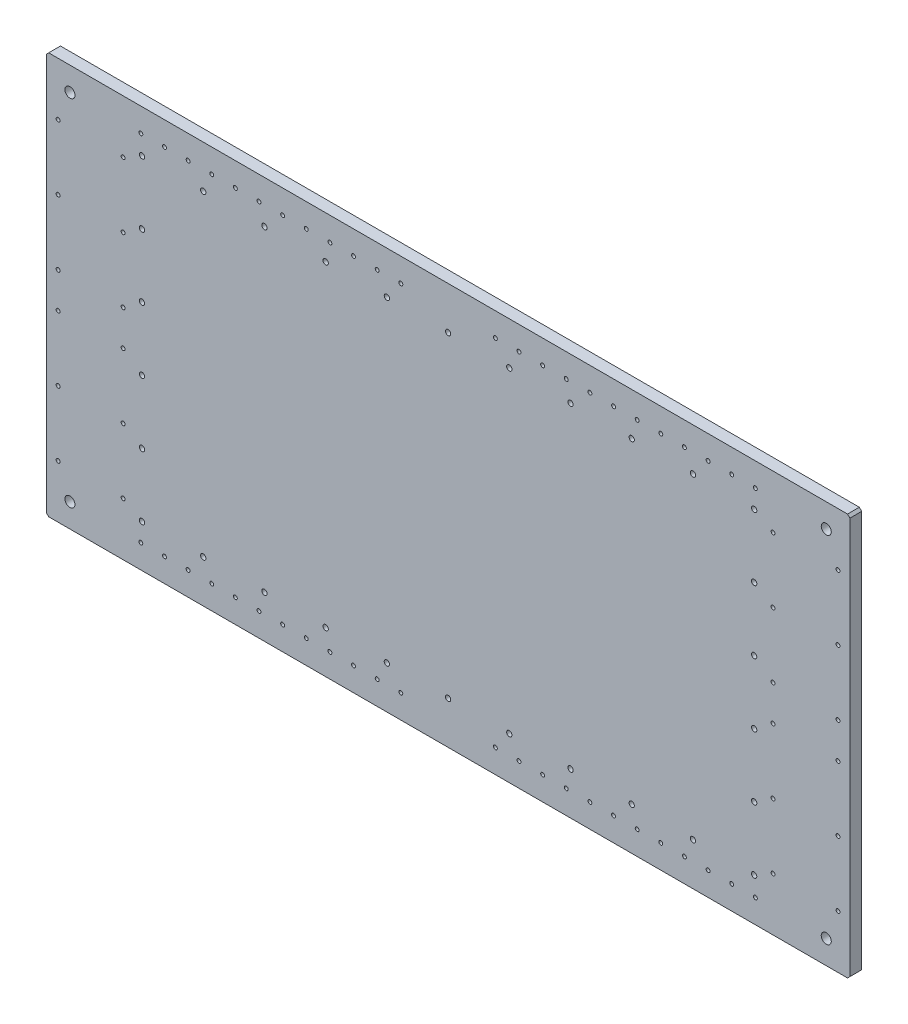
from build123d import *
from build123d.topology import SkipClean

# Parameters (mm, degrees)
SKETCH1_R              = 2.25
BOSS_EXTRUDE1_DEPTH    = 10
SKETCH2_W              = 10
SKETCH2_H              = 140
BOSS_EXTRUDE2_DEPTH    = 75
SKETCH3_W              = 340
SKETCH3_H              = 10
BOSS_EXTRUDE3_DEPTH    = 30
M10X1_5_TAPPED_HOLE1_D = 8.5
M4X0_7_TAPPED_HOLE1_D  = 3.3
LPATTERN1_COUNT        = 12
LPATTERN1_PITCH        = 20
M4X0_7_TAPPED_HOLE2_D  = 3.3
CHAMFER1_SIZE          = 2.5
MIRROR3_COPY_1_D       = 3.3
MIRROR3_COPY_2_D       = 3.3
MIRROR3_COPY_3_D       = 3.3
MIRROR3_COPY_4_D       = 3.3
MIRROR3_COPY_5_D       = 3.3
MIRROR3_COPY_6_D       = 3.3
MIRROR3_COPY_7_D       = 3.3
MIRROR3_COPY_8_D       = 3.3
MIRROR3_COPY_9_D       = 3.3
MIRROR3_COPY_10_D      = 3.3
MIRROR3_COPY_11_D      = 3.3
MIRROR4_COPY_1_D       = 8.5
MIRROR4_COPY_2_D       = 3.3
MIRROR4_COPY_3_D       = 3.3
MIRROR4_COPY_4_D       = 3.3
MIRROR4_COPY_5_D       = 3.3
MIRROR4_COPY_6_D       = 3.3
MIRROR4_COPY_7_D       = 3.3
MIRROR4_COPY_8_D       = 3.3
MIRROR4_COPY_9_D       = 3.3
MIRROR4_COPY_10_D      = 3.3
MIRROR4_COPY_11_D      = 3.3
MIRROR4_COPY_12_D      = 3.3
MIRROR4_COPY_13_D      = 3.3
MIRROR4_COPY_14_D      = 3.3
MIRROR4_COPY_15_D      = 8.5
MIRROR4_COPY_16_D      = 3.3
MIRROR4_COPY_17_D      = 3.3
CHAMFER2_SIZE          = 2


with BuildPart() as part:
    # Sketch1 → Boss-Extrude1 (new body)
    with BuildSketch(Plane.XY):
        with BuildLine():
            Line((265, 8.25), (265, 140))
            Line((265, 140), (0, 140))
            Line((0, 140), (0, 0))
            Line((0, 0), (265, 0))
            Line((265, 0), (265, 3.75))
            ThreePointArc((265, 3.75), (262.75, 6), (265, 8.25))
        make_face()
        with Locations((6, 113.2)):
            Circle(SKETCH1_R, mode=Mode.SUBTRACT)
        with Locations((6, 59.6)):
            Circle(SKETCH1_R, mode=Mode.SUBTRACT)
        with Locations((6, 6)):
            Circle(SKETCH1_R, mode=Mode.SUBTRACT)
        with Locations((57.8, 6)):
            Circle(SKETCH1_R, mode=Mode.SUBTRACT)
        with Locations((109.6, 6)):
            Circle(SKETCH1_R, mode=Mode.SUBTRACT)
        with Locations((161.4, 6)):
            Circle(SKETCH1_R, mode=Mode.SUBTRACT)
        with Locations((213.2, 6)):
            Circle(SKETCH1_R, mode=Mode.SUBTRACT)
    extrude(amount=BOSS_EXTRUDE1_DEPTH)

    # Sketch2 → Boss-Extrude2 (add)
    with BuildSketch(Plane.ZY):
        with Locations((5, 70)):
            Rectangle(SKETCH2_W, SKETCH2_H)
    extrude(amount=BOSS_EXTRUDE2_DEPTH)

    # Sketch3 → Boss-Extrude3 (add)
    with BuildSketch(Plane.XZ):
        with Locations((95, 5)):
            Rectangle(SKETCH3_W, SKETCH3_H)
    extrude(amount=BOSS_EXTRUDE3_DEPTH)

    # M10x1.5 Tapped Hole1 (through all)
    with Locations(Plane(origin=(-55, -10, 10), x_dir=(1, 0, 0), z_dir=(0, 0, 1))):
        with Locations((0, 0)):
            m10x1_5_tapped_hole1 = Hole(M10X1_5_TAPPED_HOLE1_D / 2)

    # M4x0.7 Tapped Hole1 (through all)
    with Locations(Plane(origin=(225, -10, 10), x_dir=(1, 0, 0), z_dir=(0, 0, 1))):
        with Locations((0, 0)):
            m4x0_7_tapped_hole1 = Hole(M4X0_7_TAPPED_HOLE1_D / 2)

    # LPattern1: M4x0.7 Tapped Hole1 ×12
    with Locations(*[(-i * LPATTERN1_PITCH, 0, 0) for i in range(1, LPATTERN1_COUNT)]):
        add(m4x0_7_tapped_hole1, mode=Mode.SUBTRACT)

    # M4x0.7 Tapped Hole2 (through all)
    with Locations(Plane(origin=(-10, 125, 10), x_dir=(1, 0, 0), z_dir=(0, 0, 1))):
        with Locations((0, 0), (0, -55), (0, -110), (-55, 0), (-55, -55), (-55, -110)):
            m4x0_7_tapped_hole2 = Hole(M4X0_7_TAPPED_HOLE2_D / 2)

    # Chamfer1
    chamfer1_edges = [part.edges().sort_by_distance(p)[0] for p in [
        (107.35, 6, 0),
        (159.15, 6, 0),
        (210.95, 6, 0),
        (55.55, 6, 0),
        (3.75, 6, 0),
        (3.75, 59.6, 0),
        (3.75, 113.2, 0),
        (262.75, 6, 0),
    ]]
    chamfer(chamfer1_edges, length=CHAMFER1_SIZE)

    # Mirror1: part across plane


with BuildPart() as part_1:
    with SkipClean():  # the faces are left unmerged after this step: merging them gives an invalid solid
        add(part.part)
        add(part.part.mirror(Plane(origin=(265, 8.25, 10), x_dir=(0, 0, 1), z_dir=(-1, 0, 0))))

    # Mirror2: part across plane


with BuildPart() as part_2:
    with SkipClean():  # the faces are left unmerged after this step: merging them gives an invalid solid
        add(part_1.part)
        add(part_1.part.mirror(Plane(origin=(0, 140, 10), x_dir=(0, 0, 1), z_dir=(0, 1, 0))))

    # Mirror3: M10x1.5 Tapped Hole1, M4x0.7 Tapped Hole1, M4x0.7 Tapped Hole2 across plane
    with SkipClean():  # the faces are left unmerged after this step: merging them gives an invalid solid
        add(m10x1_5_tapped_hole1.mirror(Plane(origin=(265, 0, 0), x_dir=(0, 0, 1), z_dir=(1, 0, 0))), mode=Mode.SUBTRACT)
        add(m4x0_7_tapped_hole1.mirror(Plane(origin=(265, 0, 0), x_dir=(0, 0, 1), z_dir=(1, 0, 0))), mode=Mode.SUBTRACT)
        add(m4x0_7_tapped_hole2.mirror(Plane(origin=(265, 0, 0), x_dir=(0, 0, 1), z_dir=(1, 0, 0))), mode=Mode.SUBTRACT)

    # Mirror3 copy 1 (through all)
    with Locations(Plane(origin=(325, -10, 10), x_dir=(-1, 0, 0), z_dir=(0, 0, 1))):
        with Locations((0, 0)):
            Hole(MIRROR3_COPY_1_D / 2)

    # Mirror3 copy 2 (through all)
    with Locations(Plane(origin=(345, -10, 10), x_dir=(-1, 0, 0), z_dir=(0, 0, 1))):
        with Locations((0, 0)):
            Hole(MIRROR3_COPY_2_D / 2)

    # Mirror3 copy 3 (through all)
    with Locations(Plane(origin=(365, -10, 10), x_dir=(-1, 0, 0), z_dir=(0, 0, 1))):
        with Locations((0, 0)):
            Hole(MIRROR3_COPY_3_D / 2)

    # Mirror3 copy 4 (through all)
    with Locations(Plane(origin=(385, -10, 10), x_dir=(-1, 0, 0), z_dir=(0, 0, 1))):
        with Locations((0, 0)):
            Hole(MIRROR3_COPY_4_D / 2)

    # Mirror3 copy 5 (through all)
    with Locations(Plane(origin=(405, -10, 10), x_dir=(-1, 0, 0), z_dir=(0, 0, 1))):
        with Locations((0, 0)):
            Hole(MIRROR3_COPY_5_D / 2)

    # Mirror3 copy 6 (through all)
    with Locations(Plane(origin=(425, -10, 10), x_dir=(-1, 0, 0), z_dir=(0, 0, 1))):
        with Locations((0, 0)):
            Hole(MIRROR3_COPY_6_D / 2)

    # Mirror3 copy 7 (through all)
    with Locations(Plane(origin=(445, -10, 10), x_dir=(-1, 0, 0), z_dir=(0, 0, 1))):
        with Locations((0, 0)):
            Hole(MIRROR3_COPY_7_D / 2)

    # Mirror3 copy 8 (through all)
    with Locations(Plane(origin=(465, -10, 10), x_dir=(-1, 0, 0), z_dir=(0, 0, 1))):
        with Locations((0, 0)):
            Hole(MIRROR3_COPY_8_D / 2)

    # Mirror3 copy 9 (through all)
    with Locations(Plane(origin=(485, -10, 10), x_dir=(-1, 0, 0), z_dir=(0, 0, 1))):
        with Locations((0, 0)):
            Hole(MIRROR3_COPY_9_D / 2)

    # Mirror3 copy 10 (through all)
    with Locations(Plane(origin=(505, -10, 10), x_dir=(-1, 0, 0), z_dir=(0, 0, 1))):
        with Locations((0, 0)):
            Hole(MIRROR3_COPY_10_D / 2)

    # Mirror3 copy 11 (through all)
    with Locations(Plane(origin=(525, -10, 10), x_dir=(-1, 0, 0), z_dir=(0, 0, 1))):
        with Locations((0, 0)):
            Hole(MIRROR3_COPY_11_D / 2)

    # Mirror4 copy 1 (through all)
    with Locations(Plane(origin=(585, 290, 10), x_dir=(-1, 0, 0), z_dir=(0, 0, 1))):
        with Locations((0, 0)):
            Hole(MIRROR4_COPY_1_D / 2)

    # Mirror4 copy 2 (through all)
    with Locations(Plane(origin=(305, 290, 10), x_dir=(-1, 0, 0), z_dir=(0, 0, 1))):
        with Locations((0, 0)):
            Hole(MIRROR4_COPY_2_D / 2)

    # Mirror4 copy 3 (through all)
    with Locations(Plane(origin=(540, 155, 10), x_dir=(-1, 0, 0), z_dir=(0, 0, 1))):
        with Locations((0, 0), (0, -55), (0, -110), (-55, 0), (-55, -55), (-55, -110)):
            Hole(MIRROR4_COPY_3_D / 2)

    # Mirror4 copy 4 (through all)
    with Locations(Plane(origin=(325, 290, 10), x_dir=(-1, 0, 0), z_dir=(0, 0, 1))):
        with Locations((0, 0)):
            Hole(MIRROR4_COPY_4_D / 2)

    # Mirror4 copy 5 (through all)
    with Locations(Plane(origin=(345, 290, 10), x_dir=(-1, 0, 0), z_dir=(0, 0, 1))):
        with Locations((0, 0)):
            Hole(MIRROR4_COPY_5_D / 2)

    # Mirror4 copy 6 (through all)
    with Locations(Plane(origin=(365, 290, 10), x_dir=(-1, 0, 0), z_dir=(0, 0, 1))):
        with Locations((0, 0)):
            Hole(MIRROR4_COPY_6_D / 2)

    # Mirror4 copy 7 (through all)
    with Locations(Plane(origin=(385, 290, 10), x_dir=(-1, 0, 0), z_dir=(0, 0, 1))):
        with Locations((0, 0)):
            Hole(MIRROR4_COPY_7_D / 2)

    # Mirror4 copy 8 (through all)
    with Locations(Plane(origin=(405, 290, 10), x_dir=(-1, 0, 0), z_dir=(0, 0, 1))):
        with Locations((0, 0)):
            Hole(MIRROR4_COPY_8_D / 2)

    # Mirror4 copy 9 (through all)
    with Locations(Plane(origin=(425, 290, 10), x_dir=(-1, 0, 0), z_dir=(0, 0, 1))):
        with Locations((0, 0)):
            Hole(MIRROR4_COPY_9_D / 2)

    # Mirror4 copy 10 (through all)
    with Locations(Plane(origin=(445, 290, 10), x_dir=(-1, 0, 0), z_dir=(0, 0, 1))):
        with Locations((0, 0)):
            Hole(MIRROR4_COPY_10_D / 2)

    # Mirror4 copy 11 (through all)
    with Locations(Plane(origin=(465, 290, 10), x_dir=(-1, 0, 0), z_dir=(0, 0, 1))):
        with Locations((0, 0)):
            Hole(MIRROR4_COPY_11_D / 2)

    # Mirror4 copy 12 (through all)
    with Locations(Plane(origin=(485, 290, 10), x_dir=(-1, 0, 0), z_dir=(0, 0, 1))):
        with Locations((0, 0)):
            Hole(MIRROR4_COPY_12_D / 2)

    # Mirror4 copy 13 (through all)
    with Locations(Plane(origin=(505, 290, 10), x_dir=(-1, 0, 0), z_dir=(0, 0, 1))):
        with Locations((0, 0)):
            Hole(MIRROR4_COPY_13_D / 2)

    # Mirror4 copy 14 (through all)
    with Locations(Plane(origin=(525, 290, 10), x_dir=(-1, 0, 0), z_dir=(0, 0, 1))):
        with Locations((0, 0)):
            Hole(MIRROR4_COPY_14_D / 2)

    # Mirror4 copy 15 (through all)
    with Locations(Plane(origin=(-55, 290, 10), x_dir=(1, 0, 0), z_dir=(0, 0, 1))):
        with Locations((0, 0)):
            Hole(MIRROR4_COPY_15_D / 2)

    # Mirror4 copy 16 (through all)
    with Locations(Plane(origin=(225, 290, 10), x_dir=(1, 0, 0), z_dir=(0, 0, 1))):
        with Locations((0, 0)):
            Hole(MIRROR4_COPY_16_D / 2)

    # Mirror4 copy 17 (through all)
    with Locations(Plane(origin=(-10, 155, 10), x_dir=(1, 0, 0), z_dir=(0, 0, 1))):
        with Locations((0, 0), (0, 55), (0, 110), (-55, 0), (-55, 55), (-55, 110)):
            Hole(MIRROR4_COPY_17_D / 2)

    # Chamfer2
    chamfer2_edges = [part_2.edges().sort_by_distance(p)[0] for p in [
        (605, -30, 5),
        (-75, 310, 5),
        (605, 310, 5),
        (-75, -30, 5),
    ]]
    chamfer(chamfer2_edges, length=CHAMFER2_SIZE)


solid = part_2.part
